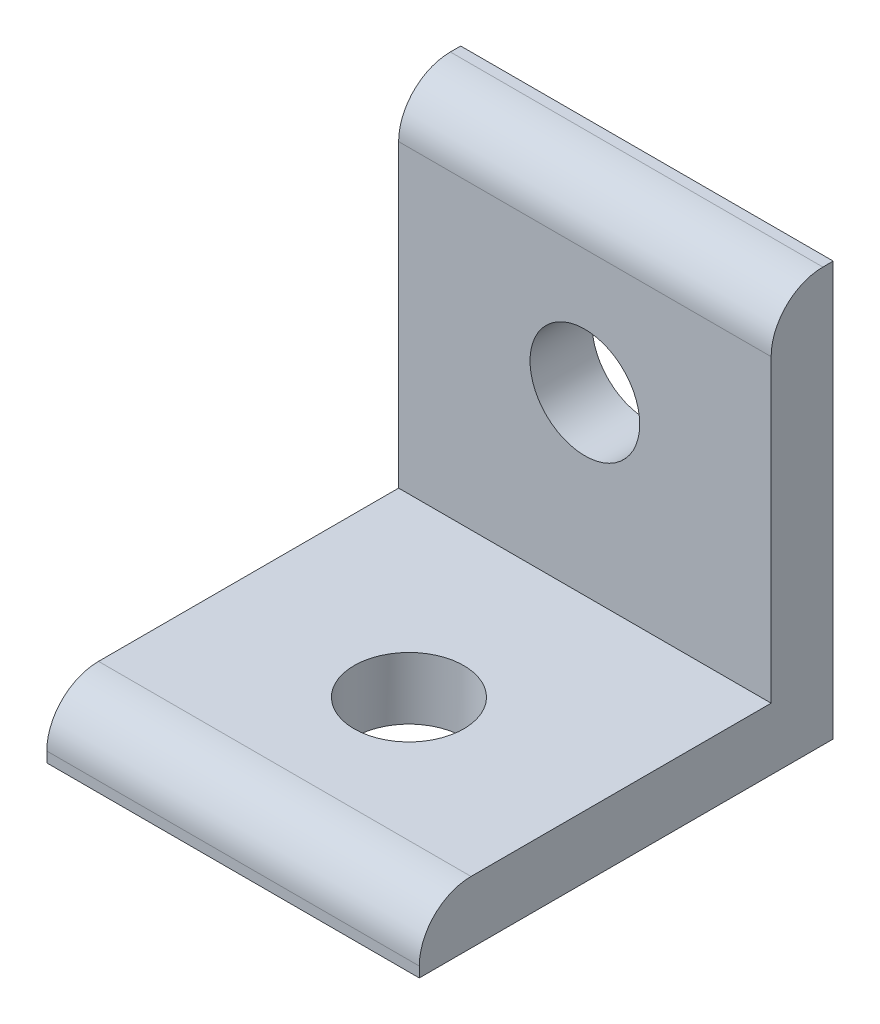
from build123d import *

# Parameters (mm, degrees)
SKETCH1_W           = 18
SKETCH1_H           = 20
BOSS_EXTRUDE3_DEPTH = 3
SKETCH4_W           = 18
SKETCH4_H           = 3
BOSS_EXTRUDE4_DEPTH = 17
SKETCH5_R           = 2.65
CUT_EXTRUDE1_DEPTH  = 3
SKETCH6_R           = 2.65
CUT_EXTRUDE2_DEPTH  = 3
FILLET1_R           = 2.5


with BuildPart() as part:
    # Sketch1 → Boss-Extrude3 (new body)
    with BuildSketch(Plane(origin=(0, 0, 0), x_dir=(1, 0, 0), z_dir=(0, 1, 0))):
        with Locations((9, -10)):
            Rectangle(SKETCH1_W, SKETCH1_H)
    extrude(amount=BOSS_EXTRUDE3_DEPTH)

    # Sketch4 → Boss-Extrude4 (add)
    with BuildSketch(Plane(origin=(0, 3, 0), x_dir=(1, 0, 0), z_dir=(0, 1, 0))):
        with Locations((9, -1.5)):
            Rectangle(SKETCH4_W, SKETCH4_H)
    extrude(amount=BOSS_EXTRUDE4_DEPTH)

    # Sketch5 → Cut-Extrude1 (cut)
    with BuildSketch(Plane(origin=(0, 3, 0), x_dir=(1, 0, 0), z_dir=(0, 1, 0))):
        with Locations(Location((9, -11.5, 0), (0, 0, 270))):
            Circle(SKETCH5_R)
    extrude(amount=-CUT_EXTRUDE1_DEPTH, mode=Mode.SUBTRACT)

    # Sketch6 → Cut-Extrude2 (cut)
    with BuildSketch(Plane.XY.offset(3)):
        with Locations((9, 11.5)):
            Circle(SKETCH6_R)
    extrude(amount=-CUT_EXTRUDE2_DEPTH, mode=Mode.SUBTRACT)

    # Fillet1
    fillet1_edges = [part.edges().sort_by_distance(p)[0] for p in [
        (9, 20, 3),
        (9, 3, 20),
    ]]
    fillet(fillet1_edges, radius=FILLET1_R)


solid = part.part
